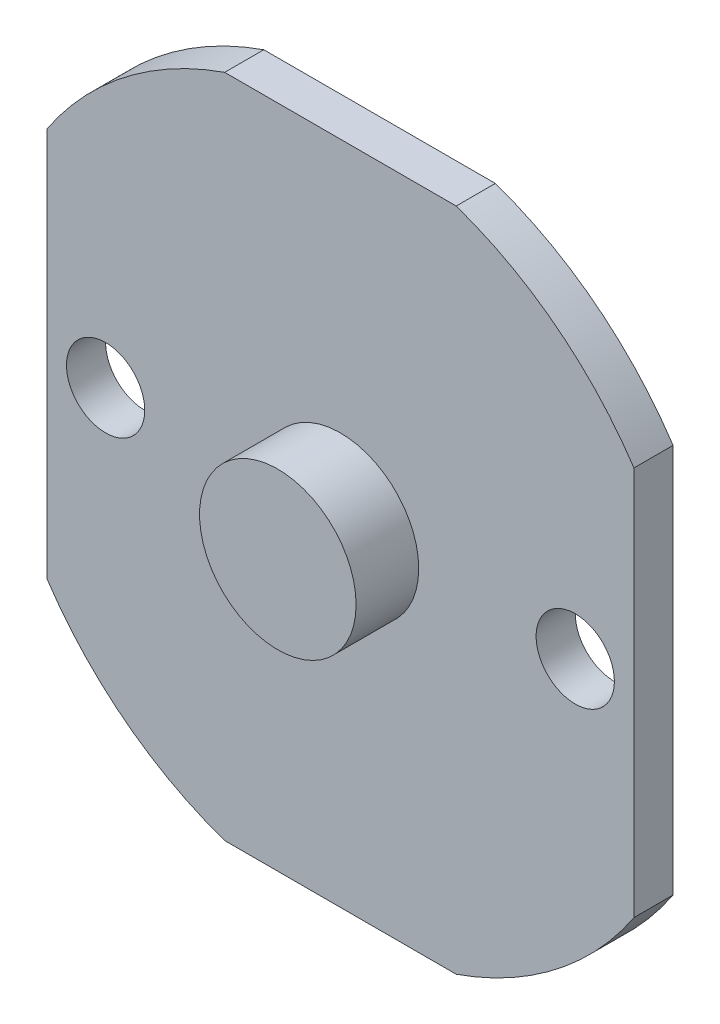
from build123d import *

# Parameters (mm, degrees)
SKETCH_1_R          = 9
SKETCH_1_R_2        = 1
EXTRUDE_1_DEPTH     = 1
SKETCH_2_W          = 32.389432278
SKETCH_2_H          = 26.120675296
SKETCH_2_W_2        = 15
SKETCH_2_H_2        = 17
CUT_EXTRUDE_1_DEPTH = 2
SKETCH_3_R          = 2
EXTRUDE_2_DEPTH     = 1.6


with BuildPart() as part:
    # 草图1 → 凸台-拉伸1 (new body)
    with BuildSketch(Plane.XY):
        Circle(SKETCH_1_R)
        with Locations((6, 0)):
            Circle(SKETCH_1_R_2, mode=Mode.SUBTRACT)
        with Locations((-6, 0)):
            Circle(SKETCH_1_R_2, mode=Mode.SUBTRACT)
    extrude(amount=EXTRUDE_1_DEPTH)

    # 草图2 → 切除-拉伸1 (cut)
    with BuildSketch(Plane.XY.offset(1)):
        Rectangle(SKETCH_2_W, SKETCH_2_H)
        Rectangle(SKETCH_2_W_2, SKETCH_2_H_2, mode=Mode.SUBTRACT)
    extrude(amount=-CUT_EXTRUDE_1_DEPTH, mode=Mode.SUBTRACT)

    # 草图3 → 凸台-拉伸2 (add)
    with BuildSketch(Plane.XY.offset(1)):
        Circle(SKETCH_3_R)
    extrude(amount=EXTRUDE_2_DEPTH)


solid = part.part
